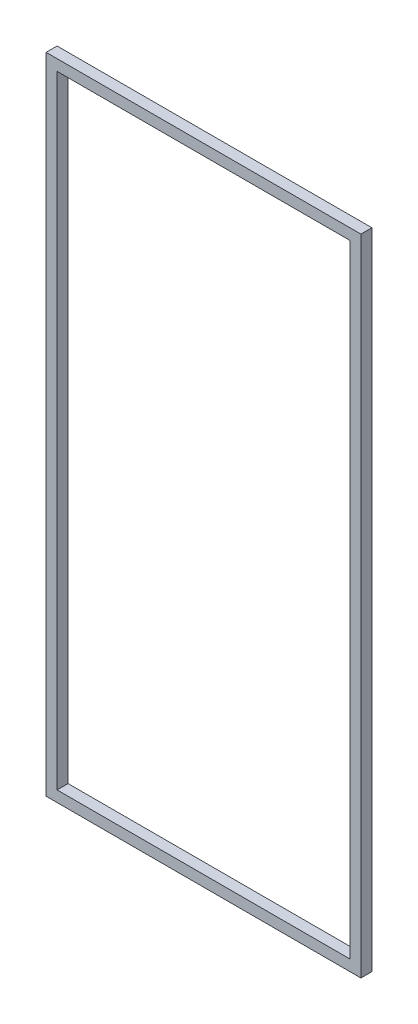
from build123d import *

# Parameters (mm, degrees)
SKETCH_1_W      = 430
SKETCH_1_H      = 880
SKETCH_1_W_2    = 400
SKETCH_1_H_2    = 850
EXTRUDE_1_DEPTH = 15


with BuildPart() as part:
    # 草图1 → 拉伸-薄壁1 (new body)
    with BuildSketch(Plane.XY):
        Rectangle(SKETCH_1_W, SKETCH_1_H)
        Rectangle(SKETCH_1_W_2, SKETCH_1_H_2, mode=Mode.SUBTRACT)
    extrude(amount=EXTRUDE_1_DEPTH)


solid = part.part
